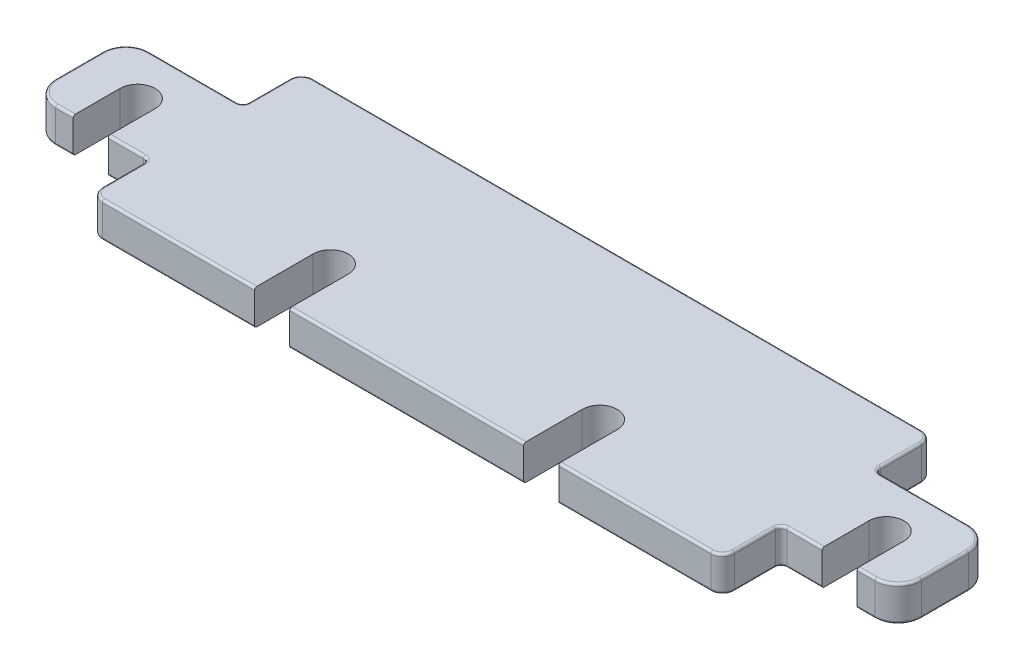
from build123d import *

# Parameters (mm, degrees)
BOSS_EXTRUDE1_DEPTH = 3
FILLET1_R           = 0.2


with BuildPart() as part:
    # Sketch1 → Boss-Extrude1 (new body)
    with BuildSketch(Plane(origin=(0, 0, 0), x_dir=(1, 0, 0), z_dir=(0, 1, 0))):
        with BuildLine():
            Line((-10, 5), (-10, 0))
            Line((-10, 0), (10, 0))
            Line((10, 0), (10, 5))
            ThreePointArc((10, 5), (11.5, 6.5), (13, 5))
            Line((13, 5), (13, 0))
            Line((13, 0), (26, 0))
            ThreePointArc((26, 0), (26.707106781, 0.292893219), (27, 1))
            Line((27, 1), (27, 4.5))
            ThreePointArc((27, 4.5), (27.146446609, 4.853553391), (27.5, 5))
            Line((27.5, 5), (30.5, 5))
            Line((30.5, 5), (30.5, 9))
            ThreePointArc((30.5, 9), (32, 10.5), (33.5, 9))
            Line((33.5, 9), (33.5, 5))
            Line((33.5, 5), (35, 5))
            ThreePointArc((35, 5), (36.414213562, 5.585786438), (37, 7))
            Line((37, 7), (37, 11))
            ThreePointArc((37, 11), (36.414213562, 12.414213562), (35, 13))
            Line((35, 13), (27.5, 13))
            ThreePointArc((27.5, 13), (27.146446609, 13.146446609), (27, 13.5))
            Line((27, 13.5), (27, 17))
            ThreePointArc((27, 17), (26.707106781, 17.707106781), (26, 18))
            Line((26, 18), (-26, 18))
            ThreePointArc((-26, 18), (-26.707106781, 17.707106781), (-27, 17))
            Line((-27, 17), (-27, 13.5))
            ThreePointArc((-27, 13.5), (-27.146446609, 13.146446609), (-27.5, 13))
            Line((-27.5, 13), (-35, 13))
            ThreePointArc((-35, 13), (-36.414213562, 12.414213562), (-37, 11))
            Line((-37, 11), (-37, 7))
            ThreePointArc((-37, 7), (-36.414213562, 5.585786438), (-35, 5))
            Line((-35, 5), (-33.5, 5))
            Line((-33.5, 5), (-33.5, 9))
            ThreePointArc((-33.5, 9), (-32, 10.5), (-30.5, 9))
            Line((-30.5, 9), (-30.5, 5))
            Line((-30.5, 5), (-27.5, 5))
            ThreePointArc((-27.5, 5), (-27.146446609, 4.853553391), (-27, 4.5))
            Line((-27, 4.5), (-27, 1))
            ThreePointArc((-27, 1), (-26.707106781, 0.292893219), (-26, 0))
            Line((-26, 0), (-13, 0))
            Line((-13, 0), (-13, 5))
            ThreePointArc((-13, 5), (-11.5, 6.5), (-10, 5))
        make_face()
    extrude(amount=BOSS_EXTRUDE1_DEPTH)

    # Fillet1
    fillet1_edges = [part.edges().sort_by_distance(p)[0] for p in [
        (0, 3, 0),
        (-29, 3, -5),
        (-27.146446609, 3, -4.853553391),
        (-27, 3, -2.75),
        (-26.707106781, 3, -0.292893219),
        (-19.5, 3, 0),
        (19.5, 3, 0),
        (26.707106781, 3, -0.292893219),
        (27, 3, -2.75),
        (27.146446609, 3, -4.853553391),
        (-19.5, 0, 0),
        (29, 3, -5),
        (-26.707106781, 0, -0.292893219),
        (-27, 0, -2.75),
        (-27.146446609, 0, -4.853553391),
        (-29, 0, -5),
        (-34.25, 0, -5),
        (-36.414213562, 0, -5.585786438),
        (-37, 0, -9),
        (-36.414213562, 0, -12.414213562),
        (-31.25, 0, -13),
        (-27.146446609, 0, -13.146446609),
        (-27, 0, -15.25),
        (-26.707106781, 0, -17.707106781),
        (0, 0, -18),
        (26.707106781, 0, -17.707106781),
        (27, 0, -15.25),
        (27.146446609, 0, -13.146446609),
        (31.25, 0, -13),
        (36.414213562, 0, -12.414213562),
        (37, 0, -9),
        (36.414213562, 0, -5.585786438),
        (34.25, 0, -5),
        (29, 0, -5),
        (27.146446609, 0, -4.853553391),
        (27, 0, -2.75),
        (34.25, 3, -5),
        (26.707106781, 0, -0.292893219),
        (19.5, 0, 0),
        (0, 0, 0),
        (36.414213562, 3, -5.585786438),
        (37, 3, -9),
        (36.414213562, 3, -12.414213562),
        (31.25, 3, -13),
        (27.146446609, 3, -13.146446609),
        (27, 3, -15.25),
        (26.707106781, 3, -17.707106781),
        (0, 3, -18),
        (-26.707106781, 3, -17.707106781),
        (-27, 3, -15.25),
        (-27.146446609, 3, -13.146446609),
        (-31.25, 3, -13),
        (-36.414213562, 3, -12.414213562),
        (-37, 3, -9),
        (-36.414213562, 3, -5.585786438),
        (-34.25, 3, -5),
    ]]
    fillet(fillet1_edges, radius=FILLET1_R)


solid = part.part
